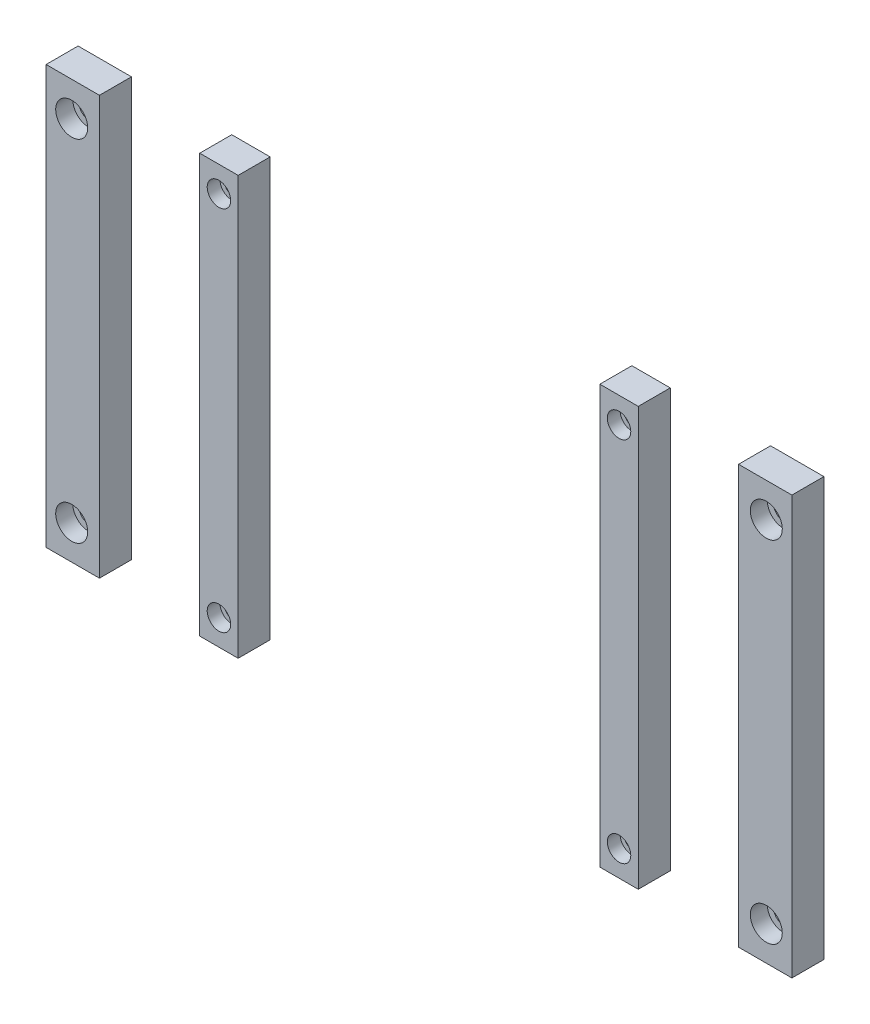
from build123d import *

# Parameters (mm, degrees)
SKETCH1_W                     = 18
SKETCH1_H                     = 196
BOSS_EXTRUDE1_DEPTH           = 15
SKETCH1_W_2                   = 25
BOSS_EXTRUDE1_2_DEPTH         = 15
BOSS_EXTRUDE1_3_DEPTH         = 15
BOSS_EXTRUDE1_4_DEPTH         = 15
CBORE_FOR_M6_SHCS1_AT_2_COUNT = 2
CBORE_FOR_M6_SHCS1_AT_2_PITCH = 172
CBORE_FOR_M6_SHCS2_AT_2_COUNT = 2
CBORE_FOR_M6_SHCS2_AT_2_PITCH = 172
CBORE_FOR_M8_SHCS2_AT_2_COUNT = 2
CBORE_FOR_M8_SHCS2_AT_2_PITCH = 164
CBORE_FOR_M8_SHCS3_AT_2_COUNT = 2
CBORE_FOR_M8_SHCS3_AT_2_PITCH = 164


with BuildPart() as part:
    # Sketch1 → Boss-Extrude1 (new body)
    with BuildSketch(Plane.XY):
        with Locations((-128.5, 0)):
            Rectangle(SKETCH1_W, SKETCH1_H)
    extrude(amount=BOSS_EXTRUDE1_DEPTH)

    # Sketch5 → CBORE for M6 SHCS2 (revolve, cut)
    with BuildSketch(Plane(origin=(-128.5, 86, 15), x_dir=(0, -1, 0), z_dir=(1, 0, 0))):
        Polygon((0, 0), (0, 15), (3.3, 15), (3.3, 6), (5.5, 6), (5.5, 0), align=None)
    cbore_for_m6_shcs2 = revolve(axis=Axis((-128.5, 86, 21.35), (0, 0, -1)), mode=Mode.SUBTRACT)

    # CBORE for M6 SHCS2 at 2: CBORE for M6 SHCS2 ×2
    with Locations(*[(0, -i * CBORE_FOR_M6_SHCS2_AT_2_PITCH, 0) for i in range(1, CBORE_FOR_M6_SHCS2_AT_2_COUNT)]):
        add(cbore_for_m6_shcs2, mode=Mode.SUBTRACT)


with BuildPart() as body_2:
    # Sketch1 → Boss-Extrude1 2 (new body)
    with BuildSketch(Plane.XY):
        with Locations((127.5, 0)):
            Rectangle(SKETCH1_W_2, SKETCH1_H)
    extrude(amount=BOSS_EXTRUDE1_2_DEPTH)

    # Sketch7 → CBORE for M8 SHCS2 (revolve, cut)
    with BuildSketch(Plane(origin=(128, -82, 15), x_dir=(0, -1, 0), z_dir=(1, 0, 0))):
        Polygon((0, 0), (0, 15), (4.5, 15), (4.5, 8), (7.5, 8), (7.5, 0), align=None)
    cbore_for_m8_shcs2 = revolve(axis=Axis((128, -82, 21.35), (0, 0, -1)), mode=Mode.SUBTRACT)

    # CBORE for M8 SHCS2 at 2: CBORE for M8 SHCS2 ×2
    with Locations(*[(0, i * CBORE_FOR_M8_SHCS2_AT_2_PITCH, 0) for i in range(1, CBORE_FOR_M8_SHCS2_AT_2_COUNT)]):
        add(cbore_for_m8_shcs2, mode=Mode.SUBTRACT)


with BuildPart() as body_3:
    # Sketch1 → Boss-Extrude1 3 (new body)
    with BuildSketch(Plane.XY):
        with Locations((-197, 0)):
            Rectangle(SKETCH1_W_2, SKETCH1_H)
    extrude(amount=BOSS_EXTRUDE1_3_DEPTH)

    # Sketch9 → CBORE for M8 SHCS3 (revolve, cut)
    with BuildSketch(Plane(origin=(-197.5, 82, 15), x_dir=(0, -1, 0), z_dir=(1, 0, 0))):
        Polygon((0, 0), (0, 15), (4.5, 15), (4.5, 8), (7.5, 8), (7.5, 0), align=None)
    cbore_for_m8_shcs3 = revolve(axis=Axis((-197.5, 82, 21.35), (0, 0, -1)), mode=Mode.SUBTRACT)

    # CBORE for M8 SHCS3 at 2: CBORE for M8 SHCS3 ×2
    with Locations(*[(0, -i * CBORE_FOR_M8_SHCS3_AT_2_PITCH, 0) for i in range(1, CBORE_FOR_M8_SHCS3_AT_2_COUNT)]):
        add(cbore_for_m8_shcs3, mode=Mode.SUBTRACT)


with BuildPart() as body_4:
    # Sketch1 → Boss-Extrude1 4 (new body)
    with BuildSketch(Plane.XY):
        with Locations((59, 0)):
            Rectangle(SKETCH1_W, SKETCH1_H)
    extrude(amount=BOSS_EXTRUDE1_4_DEPTH)

    # Sketch3 → CBORE for M6 SHCS1 (revolve, cut)
    with BuildSketch(Plane(origin=(59, 86, 15), x_dir=(0, -1, 0), z_dir=(1, 0, 0))):
        Polygon((0, 0), (0, 15), (3.3, 15), (3.3, 6), (5.5, 6), (5.5, 0), align=None)
    cbore_for_m6_shcs1 = revolve(axis=Axis((59, 86, 21.35), (0, 0, -1)), mode=Mode.SUBTRACT)

    # CBORE for M6 SHCS1 at 2: CBORE for M6 SHCS1 ×2
    with Locations(*[(0, -i * CBORE_FOR_M6_SHCS1_AT_2_PITCH, 0) for i in range(1, CBORE_FOR_M6_SHCS1_AT_2_COUNT)]):
        add(cbore_for_m6_shcs1, mode=Mode.SUBTRACT)


solid = Compound([part.part, body_2.part, body_3.part, body_4.part])
